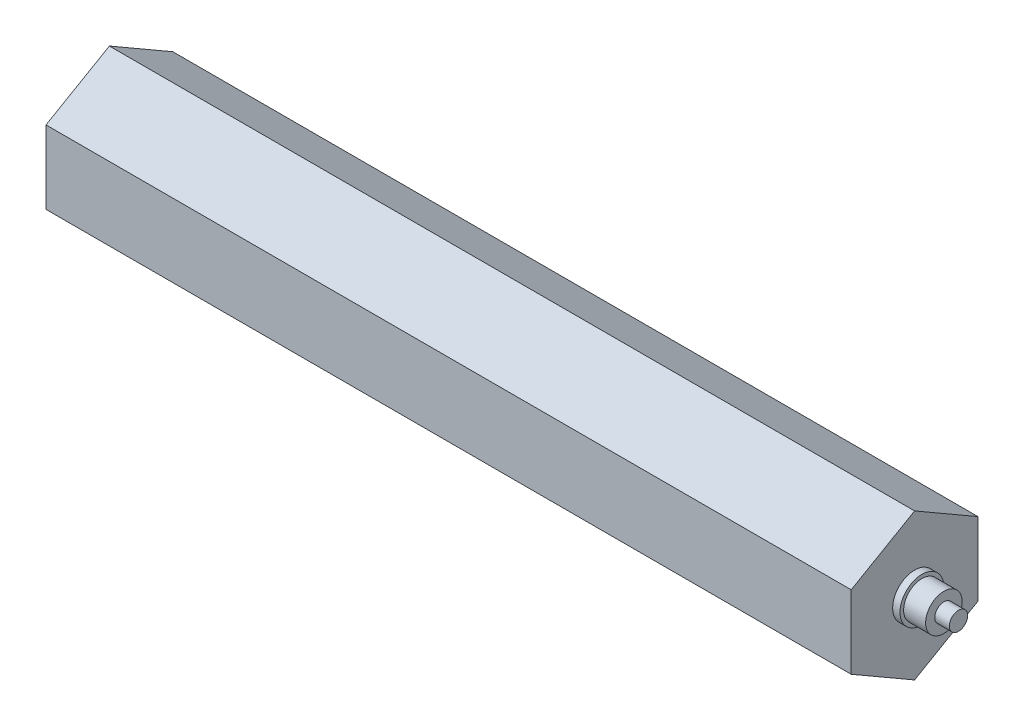
from build123d import *

# Parameters (mm, degrees)
EXTRUDE_1_DEPTH = 220
SKETCH_2_R      = 5
EXTRUDE_2_DEPTH = 8
SKETCH_3_R      = 6
EXTRUDE_3_DEPTH = 2
SKETCH_4_R      = 2.5
EXTRUDE_4_DEPTH = 4


with BuildPart() as part:
    # 草图1 → 凸台-拉伸1 (new body)
    with BuildSketch(Plane(origin=(0, 0, 0), x_dir=(0, 0, -1), z_dir=(1, 0, 0))):
        Polygon((17.320508076, -10), (17.320508076, 10), (0, 20), (-17.320508076, 10), (-17.320508076, -10), (0, -20), align=None)
    extrude(amount=EXTRUDE_1_DEPTH)

    # 草图2 → 凸台-拉伸2 (add)
    with BuildSketch(Plane(origin=(220, 0, 0), x_dir=(0, 0, -1), z_dir=(1, 0, 0))):
        Circle(SKETCH_2_R)
    extrude(amount=EXTRUDE_2_DEPTH)

    # 草图3 → 凸台-拉伸3 (add)
    with BuildSketch(Plane(origin=(220, 0, 0), x_dir=(0, 0, -1), z_dir=(1, 0, 0))):
        Circle(SKETCH_3_R)
    extrude(amount=EXTRUDE_3_DEPTH)

    # 草图4 → 凸台-拉伸4 (add)
    with BuildSketch(Plane(origin=(228, 0, 0), x_dir=(0, 0, -1), z_dir=(1, 0, 0))):
        Circle(SKETCH_4_R)
    extrude(amount=EXTRUDE_4_DEPTH)


solid = part.part
